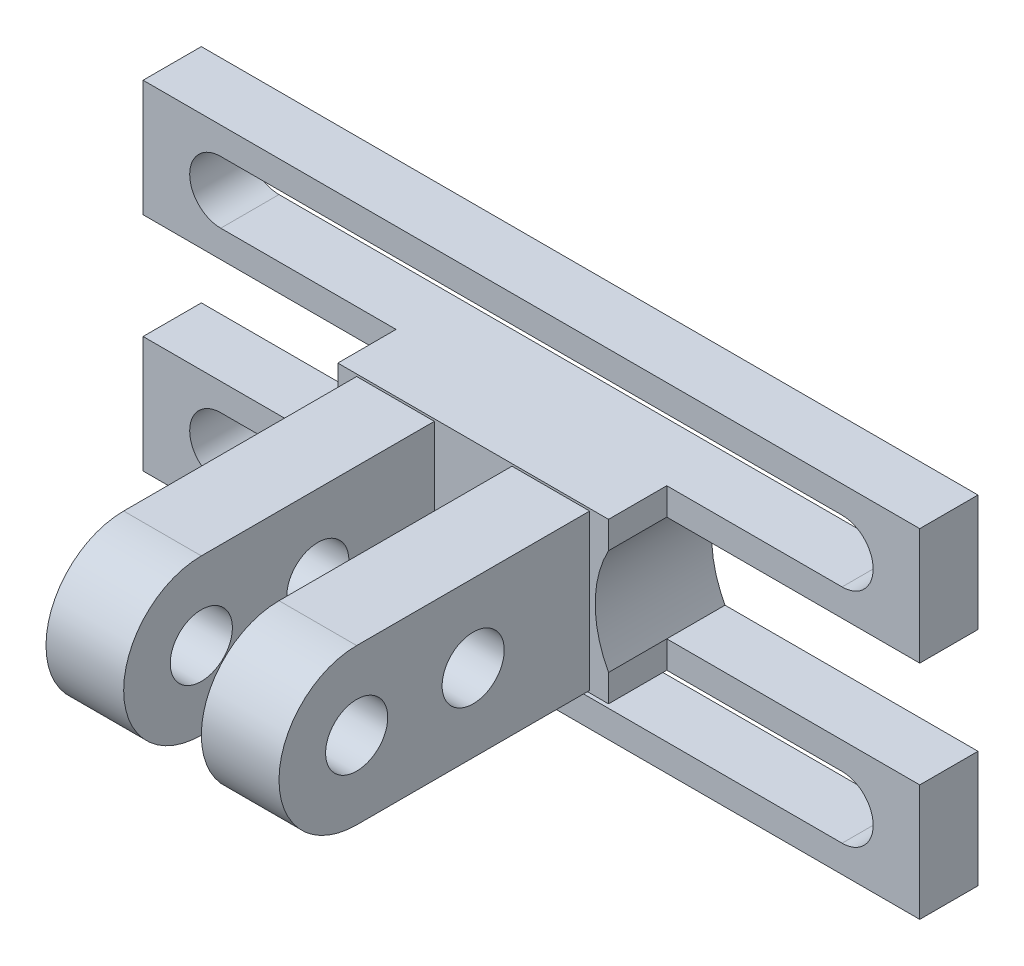
from build123d import *

# Parameters (mm, degrees)
EXTRUDE_1_DEPTH = 3
EXTRUDE_2_DEPTH = 3
EXTRUDE_START   = 2
SKETCH_3_R      = 1.6
EXTRUDE_3_DEPTH = 4


with BuildPart() as part:
    # 草图1 → 凸台-拉伸1 (new body)
    with BuildSketch(Plane.XY):
        with BuildLine():
            Line((20, 8.715), (20, 2.715))
            Line((20, 2.715), (6.971083616, 2.715))
            ThreePointArc((6.971083616, 2.715), (6.285, 0), (6.971083616, -2.715))
            Line((6.971083616, -2.715), (20, -2.715))
            Line((20, -2.715), (20, -8.715))
            Line((20, -8.715), (-20, -8.715))
            Line((-20, -8.715), (-20, -2.715))
            Line((-20, -2.715), (-6.971083616, -2.715))
            ThreePointArc((-6.971083616, -2.715), (-6.285, 0), (-6.971083616, 2.715))
            Line((-6.971083616, 2.715), (-20, 2.715))
            Line((-20, 2.715), (-20, 8.715))
            Line((-20, 8.715), (20, 8.715))
        make_face()
        with BuildLine():
            Line((16, 4.115), (-16, 4.115))
            ThreePointArc((-16, 4.115), (-17.6, 5.715), (-16, 7.315))
            Line((-16, 7.315), (16, 7.315))
            ThreePointArc((16, 7.315), (17.6, 5.715), (16, 4.115))
        make_face(mode=Mode.SUBTRACT)
        with BuildLine():
            Line((16, -7.315), (-16, -7.315))
            ThreePointArc((-16, -7.315), (-17.6, -5.715), (-16, -4.115))
            Line((-16, -4.115), (16, -4.115))
            ThreePointArc((16, -4.115), (17.6, -5.715), (16, -7.315))
        make_face(mode=Mode.SUBTRACT)
    extrude(amount=EXTRUDE_1_DEPTH)

    # 草图2 → 凸台-拉伸2 (add)
    with BuildSketch(Plane.XY.offset(3)):
        with BuildLine():
            Line((-6.971083616, 2.715), (-6.971083616, 4.115))
            Line((-6.971083616, 4.115), (6.971083616, 4.115))
            Line((6.971083616, 4.115), (6.971083616, 2.715))
            ThreePointArc((6.971083616, 2.715), (6.285, 0), (6.971083616, -2.715))
            Line((6.971083616, -2.715), (6.971083616, -4.115))
            Line((6.971083616, -4.115), (-6.971083616, -4.115))
            Line((-6.971083616, -4.115), (-6.971083616, -2.715))
            ThreePointArc((-6.971083616, -2.715), (-6.285, 0), (-6.971083616, 2.715))
        make_face()
    extrude(amount=EXTRUDE_2_DEPTH)

    # 草图3 → 凸台-拉伸3 (add)
    with BuildSketch(Plane(origin=(0, 0, 0), x_dir=(0, 0, -1), z_dir=(1, 0, 0)).offset(EXTRUDE_START)):
        with BuildLine():
            Line((-6, 4), (-18, 4))
            ThreePointArc((-18, 4), (-22, 0), (-18, -4))
            Line((-18, -4), (-6, -4))
            Line((-6, -4), (-6, 4))
        make_face()
        with Locations((-18, 0)):
            Circle(SKETCH_3_R, mode=Mode.SUBTRACT)
        with Locations((-12, 0)):
            Circle(SKETCH_3_R, mode=Mode.SUBTRACT)
    extrude_3 = extrude(amount=EXTRUDE_3_DEPTH)

    # 镜向1: 凸台-拉伸3 across plane
    add(extrude_3.mirror(Plane(origin=(0, 0, 0), x_dir=(0, 0, 1), z_dir=(1, 0, 0))))


solid = part.part
